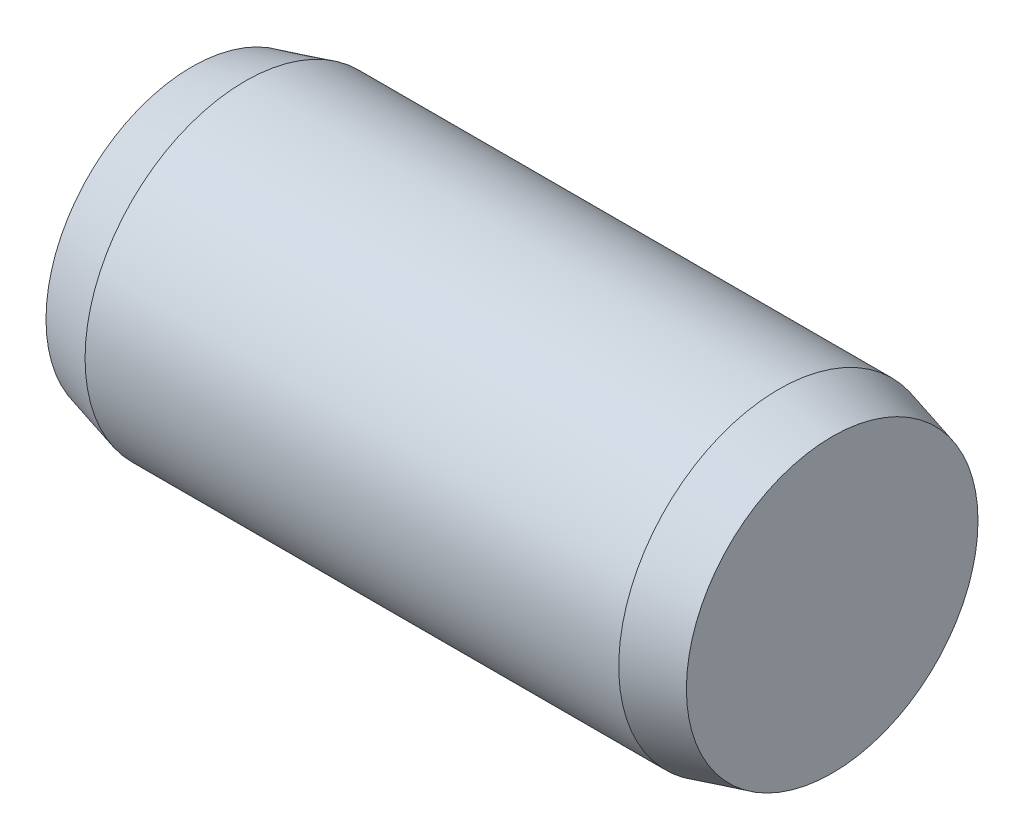
from build123d import *

# Parameters (mm, degrees)
EXTRUDE1_DEPTH      = 2.5
EXTRUDE1_DEPTH_BACK = 2.5
SKETCH2_R           = 1.5
SKETCH3_R           = 1.5
EXTRUDE2_DEPTH      = 0.5
EXTRUDE2_TAPER      = 15
SKETCH4_R           = 1.5
EXTRUDE3_DEPTH      = 0.5
EXTRUDE3_TAPER      = 15


with BuildPart() as part:
    # Sketch2 → Extrude1 (new, two sides: drawn at the far end of the back side and taken through both)
    with BuildSketch(Plane(origin=(0, 0, 0), x_dir=(0, 0, -1), z_dir=(1, 0, 0)).offset(-EXTRUDE1_DEPTH_BACK)):
        Circle(SKETCH2_R)
    extrude(amount=EXTRUDE1_DEPTH + EXTRUDE1_DEPTH_BACK)

    # Sketch3 → Extrude2 (add)
    with BuildSketch(Plane(origin=(2.5, 0, 0), x_dir=(0, 0, -1), z_dir=(1, 0, 0))):
        Circle(SKETCH3_R)
    extrude(amount=EXTRUDE2_DEPTH, taper=EXTRUDE2_TAPER)

    # Sketch4 → Extrude3 (add)
    with BuildSketch(Plane.ZY.offset(2.5)):
        with Locations(Location((0, 0, 0), (0, 0, 180))):
            Circle(SKETCH4_R)
    extrude(amount=EXTRUDE3_DEPTH, taper=EXTRUDE3_TAPER)


solid = part.part
